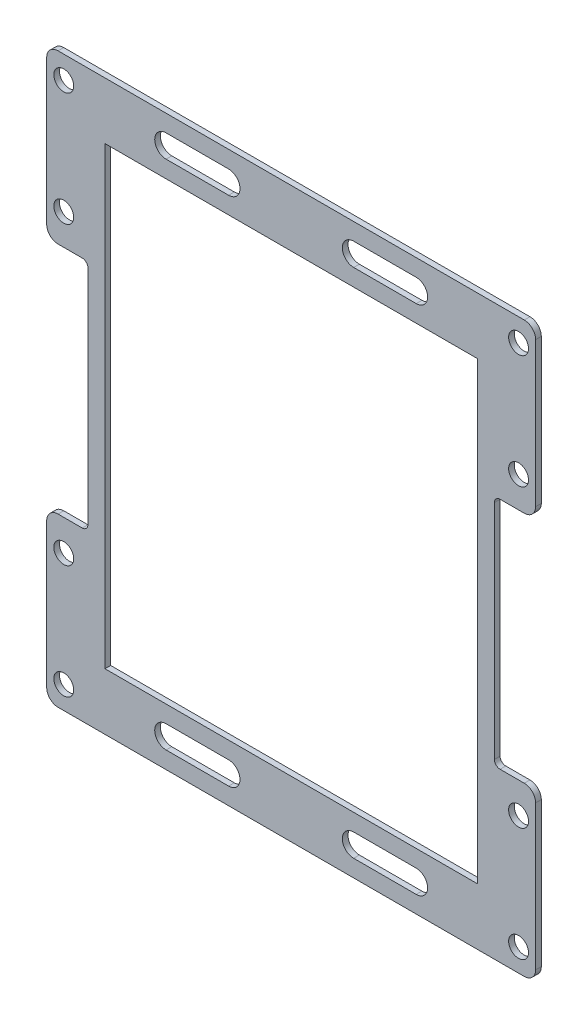
from build123d import *

# Parameters (mm, degrees)
SKETCH_1_R      = 1.75
SKETCH_1_W      = 65.5
SKETCH_1_H      = 80
EXTRUDE_1_DEPTH = 1
FILLET_1_R      = 1
FILLET_2_R      = 2


with BuildPart() as part:
    # 草圖1 → 填料-伸長1 (new body)
    with BuildSketch(Plane.XY):
        Polygon((-35.75, -20.56252042), (-43, -20.56252042), (-43, -50), (-25.75, -50), (25.75, -50), (43, -50), (43, -20.56252042), (35.75, -20.56252042), (35.75, 20.56252042), (43, 20.56252042), (43, 50), (25.75, 50), (-25.75, 50), (-43, 50), (-43, 20.56252042), (-35.75, 20.56252042), align=None)
        with Locations((-40, -26)):
            Circle(SKETCH_1_R, mode=Mode.SUBTRACT)
        with Locations(Location((40, -26, 0), (0, 0, 180))):
            Circle(SKETCH_1_R, mode=Mode.SUBTRACT)
        with Locations((40, 26)):
            Circle(SKETCH_1_R, mode=Mode.SUBTRACT)
        with Locations(Location((-40, 26, 0), (0, 0, 180))):
            Circle(SKETCH_1_R, mode=Mode.SUBTRACT)
        with Locations((-40, -46)):
            Circle(SKETCH_1_R, mode=Mode.SUBTRACT)
        with Locations(Location((-40, 46, 0), (0, 0, 180))):
            Circle(SKETCH_1_R, mode=Mode.SUBTRACT)
        with Locations((40, 46)):
            Circle(SKETCH_1_R, mode=Mode.SUBTRACT)
        with Locations(Location((40, -46, 0), (0, 0, 180))):
            Circle(SKETCH_1_R, mode=Mode.SUBTRACT)
        Rectangle(SKETCH_1_W, SKETCH_1_H, mode=Mode.SUBTRACT)
        with BuildLine():
            Line((-22, -43), (-11, -43))
            ThreePointArc((-11, -43), (-9, -45), (-11, -47))
            Line((-11, -47), (-22, -47))
            ThreePointArc((-22, -47), (-24, -45), (-22, -43))
        make_face(mode=Mode.SUBTRACT)
        with BuildLine():
            Line((22, -43), (11, -43))
            ThreePointArc((11, -43), (9, -45), (11, -47))
            Line((11, -47), (22, -47))
            ThreePointArc((22, -47), (24, -45), (22, -43))
        make_face(mode=Mode.SUBTRACT)
        with BuildLine():
            Line((22, 43), (11, 43))
            ThreePointArc((11, 43), (9, 45), (11, 47))
            Line((11, 47), (22, 47))
            ThreePointArc((22, 47), (24, 45), (22, 43))
        make_face(mode=Mode.SUBTRACT)
        with BuildLine():
            Line((-22, 43), (-11, 43))
            ThreePointArc((-11, 43), (-9, 45), (-11, 47))
            Line((-11, 47), (-22, 47))
            ThreePointArc((-22, 47), (-24, 45), (-22, 43))
        make_face(mode=Mode.SUBTRACT)
    extrude(amount=EXTRUDE_1_DEPTH)

    # 圓角1
    fillet_1_edges = [part.edges().sort_by_distance(p)[0] for p in [
        (35.75, 20.56252042, 0.5),
        (35.75, -20.56252042, 0.5),
        (-35.75, -20.56252042, 0.5),
        (-35.75, 20.56252042, 0.5),
    ]]
    fillet(fillet_1_edges, radius=FILLET_1_R)

    # 圓角2
    fillet_2_edges = [part.edges().sort_by_distance(p)[0] for p in [
        (43, 50, 0.5),
        (43, 20.56252042, 0.5),
        (43, -20.56252042, 0.5),
        (43, -50, 0.5),
        (-43, -50, 0.5),
        (-43, -20.56252042, 0.5),
        (-43, 20.56252042, 0.5),
        (-43, 50, 0.5),
    ]]
    fillet(fillet_2_edges, radius=FILLET_2_R)


solid = part.part
